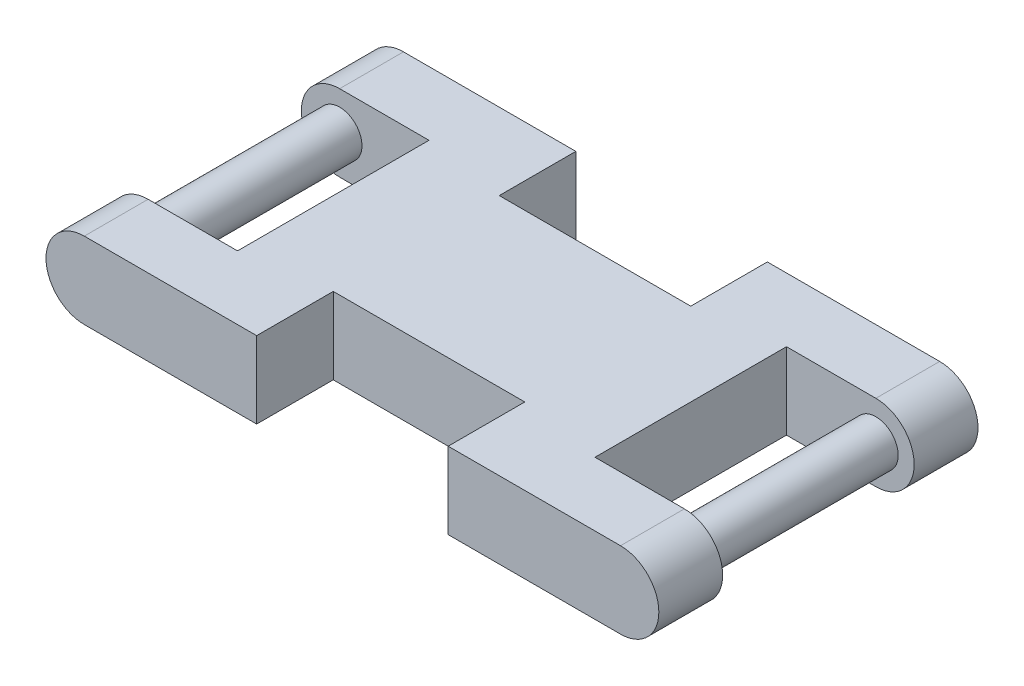
from build123d import *

# Parameters (mm, degrees)
BOSS_EXTRUDE1_DEPTH = 125
SKETCH2_W           = 35
SKETCH2_H           = 75
SKETCH2_W_2         = 15
CUT_EXTRUDE1_DEPTH  = 100
SKETCH3_R           = 8.75
BOSS_EXTRUDE2_DEPTH = 75
SKETCH4_W           = 75
SKETCH4_H           = 30
CUT_EXTRUDE2_DEPTH  = 176.855053951


with BuildPart() as part:
    # Sketch1 → Boss-Extrude1 (new body)
    with BuildSketch(Plane.XY):
        with BuildLine():
            Line((-105, 15), (105, 15))
            ThreePointArc((105, 15), (120, 0), (105, -15))
            Line((105, -15), (-105, -15))
            ThreePointArc((-105, -15), (-120, 0), (-105, 15))
        make_face()
    extrude(amount=BOSS_EXTRUDE1_DEPTH)

    # Sketch2 → Cut-Extrude1 (cut)
    with BuildSketch(Plane(origin=(0, 15, 0), x_dir=(1, 0, 0), z_dir=(0, 1, 0))):
        with Locations((-87.5, -62.5)):
            Rectangle(SKETCH2_W, SKETCH2_H)
        with Locations((-112.5, -62.5)):
            Rectangle(SKETCH2_W_2, SKETCH2_H)
        with Locations((112.5, -62.5)):
            Rectangle(SKETCH2_W_2, SKETCH2_H)
        with Locations((87.5, -62.5)):
            Rectangle(SKETCH2_W, SKETCH2_H)
    extrude(amount=-CUT_EXTRUDE1_DEPTH, mode=Mode.SUBTRACT)

    # Sketch3 → Boss-Extrude2 (add)
    with BuildSketch(Plane.XY.offset(25)):
        with Locations(Location((-105, 0, 0), (0, 0, 180))):
            Circle(SKETCH3_R)
        with Locations(Location((105, 0, 0), (0, 0, 180))):
            Circle(SKETCH3_R)
    extrude(amount=BOSS_EXTRUDE2_DEPTH)

    # Sketch4 → Cut-Extrude2 (cut, through all)
    with BuildSketch(Plane(origin=(0, 15, 0), x_dir=(1, 0, 0), z_dir=(0, 1, 0))):
        with Locations((0, -15)):
            Rectangle(SKETCH4_W, SKETCH4_H)
        with Locations((0, -110)):
            Rectangle(SKETCH4_W, SKETCH4_H)
    extrude(amount=-CUT_EXTRUDE2_DEPTH, mode=Mode.SUBTRACT)


solid = part.part
